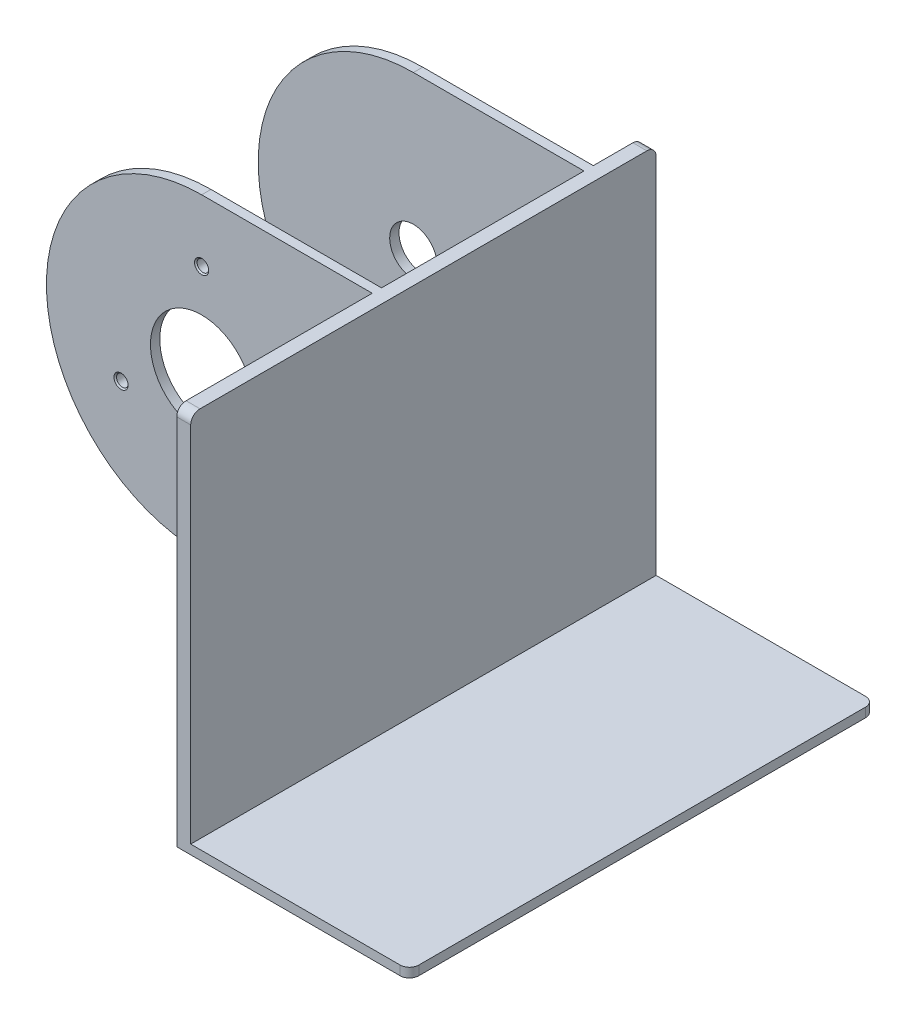
from build123d import *

# Parameters (mm, degrees)
SKETCH_1_W                   = 50
SKETCH_1_H                   = 100
EXTRUDE_1_DEPTH              = 2
SKETCH_2_W                   = 3
SKETCH_2_H                   = 100
EXTRUDE_2_DEPTH              = 80
SKETCH_3_W                   = 2
SKETCH_3_H                   = 66.7
EXTRUDE_3_DEPTH              = 70
CUT_EXTRUDE_4_REACH          = 162.465
SKETCH_8_W                   = 2
SKETCH_8_H                   = 66.7
EXTRUDE_4_DEPTH              = 70
CUT_EXTRUDE_5_REACH          = 140.25
HOLE_WIZARD_M3_1_D           = 2.5
HOLE_WIZARD_M3_1_DEPTH       = 2
HOLE_WIZARD_M3_1_CSINK_D     = 3.05
HOLE_WIZARD_M3_1_CSINK_ANGLE = 90
FILLET_1_R                   = 2
CUT_EXTRUDE_6_REACH          = 140.25
SKETCH_12_R                  = 11
CUT_EXTRUDE_7_REACH          = 162.465
SKETCH_13_R                  = 14.5
SKETCH_14_W                  = 2
SKETCH_14_H                  = 66.7
EXTRUDE_5_DEPTH              = 70
CUT_EXTRUDE_8_REACH          = 156.14
SKETCH_15_R                  = 5.1
CUT_EXTRUDE_9_DEPTH          = 155.140358116
CUT_EXTRUDE_9_DEPTH_BACK     = 155.140358116
SKETCH_19_W                  = 2
SKETCH_19_H                  = 66.7
CUT_EXTRUDE_10_DEPTH         = 119.844436134
FILLET_2_R                   = 2


with BuildPart() as part:
    # 草图1 → 凸台-拉伸1 (new body)
    with BuildSketch(Plane(origin=(0, 0, 0), x_dir=(1, 0, 0), z_dir=(0, 1, 0))):
        Rectangle(SKETCH_1_W, SKETCH_1_H)
    extrude(amount=EXTRUDE_1_DEPTH)

    # 草图2 → 凸台-拉伸2 (add)
    with BuildSketch(Plane(origin=(0, 2, 0), x_dir=(1, 0, 0), z_dir=(0, 1, 0))):
        with Locations((-23.5, 0)):
            Rectangle(SKETCH_2_W, SKETCH_2_H)
    extrude(amount=EXTRUDE_2_DEPTH)

    # 草图3 → 凸台-拉伸3 (add)
    with BuildSketch(Plane.ZY.offset(25)):
        with Locations((-49, 48.65)):
            Rectangle(SKETCH_3_W, SKETCH_3_H)
    extrude(amount=EXTRUDE_3_DEPTH)

    # 草图4 → 切除-拉伸4 (cut, up to next)
    with BuildSketch(Plane(origin=(0, 0, -50), x_dir=(-1, 0, 0), z_dir=(0, 0, -1)), mode=Mode.PRIVATE) as cut_extrude_4_sk1:
        with BuildLine():
            Line((95, 82), (61.65, 82))
            ThreePointArc((61.65, 82), (85.232011153, 72.232011153), (95, 48.65))
            Line((95, 48.65), (95, 82))
        make_face()
    cut_extrude_4_tool1 = extrude(cut_extrude_4_sk1.sketch, amount=-CUT_EXTRUDE_4_REACH, mode=Mode.PRIVATE) & part.part
    # 草图4 → 切除-拉伸4 (cut, up to next)
    with BuildSketch(Plane(origin=(0, 0, -50), x_dir=(-1, 0, 0), z_dir=(0, 0, -1)), mode=Mode.PRIVATE) as cut_extrude_4_sk2:
        with BuildLine():
            ThreePointArc((95, 48.65), (85.232011153, 25.067988847), (61.65, 15.3))
            Line((61.65, 15.3), (95, 15.3))
            Line((95, 15.3), (95, 48.65))
        make_face()
    cut_extrude_4_tool2 = extrude(cut_extrude_4_sk2.sketch, amount=-CUT_EXTRUDE_4_REACH, mode=Mode.PRIVATE) & part.part
    add(cut_extrude_4_tool1.solids().sort_by_distance((-87.550679, 74.550679, -50))[0], mode=Mode.SUBTRACT)
    add(cut_extrude_4_tool2.solids().sort_by_distance((-87.550679, 22.749321, -50))[0], mode=Mode.SUBTRACT)

    # 草图8 → 凸台-拉伸4 (add)
    with BuildSketch(Plane.ZY.offset(25)):
        with Locations((7, 48.65)):
            Rectangle(SKETCH_8_W, SKETCH_8_H)
    extrude(amount=EXTRUDE_4_DEPTH)

    # 草图9 → 切除-拉伸5 (cut, up to next)
    with BuildSketch(Plane.XY.offset(8), mode=Mode.PRIVATE) as cut_extrude_5_sk1:
        with BuildLine():
            ThreePointArc((-95, 48.65), (-85.232011153, 72.232011153), (-61.65, 82))
            Line((-61.65, 82), (-95, 82))
            Line((-95, 82), (-95, 48.65))
        make_face()
    cut_extrude_5_tool1 = extrude(cut_extrude_5_sk1.sketch, amount=-CUT_EXTRUDE_5_REACH, mode=Mode.PRIVATE) & part.part
    # 草图9 → 切除-拉伸5 (cut, up to next)
    with BuildSketch(Plane.XY.offset(8), mode=Mode.PRIVATE) as cut_extrude_5_sk2:
        with BuildLine():
            ThreePointArc((-61.65, 15.3), (-85.232011153, 25.067988847), (-95, 48.65))
            Line((-95, 48.65), (-95, 15.3))
            Line((-95, 15.3), (-61.65, 15.3))
        make_face()
    cut_extrude_5_tool2 = extrude(cut_extrude_5_sk2.sketch, amount=-CUT_EXTRUDE_5_REACH, mode=Mode.PRIVATE) & part.part
    add(cut_extrude_5_tool1.solids().sort_by_distance((-87.550679, 74.550679, 8))[0], mode=Mode.SUBTRACT)
    add(cut_extrude_5_tool2.solids().sort_by_distance((-87.550679, 22.749321, 8))[0], mode=Mode.SUBTRACT)

    # M3 螺纹孔1
    with Locations(Plane.XY.offset(8)):
        with Locations((-78.970508076, 38.65), (-61.65, 68.65), (-44.329491924, 38.65)):
            CounterSinkHole(HOLE_WIZARD_M3_1_D / 2, HOLE_WIZARD_M3_1_CSINK_D / 2, depth=HOLE_WIZARD_M3_1_DEPTH, counter_sink_angle=HOLE_WIZARD_M3_1_CSINK_ANGLE)

    # 圆角1
    fillet_1_edges = [part.edges().sort_by_distance(p)[0] for p in [
        (-23.5, 82, 50),
        (25, 1, 50),
        (25, 1, -50),
    ]]
    fillet(fillet_1_edges, radius=FILLET_1_R)

    # 草图12 → 切除-拉伸6 (cut, up to next)
    with BuildSketch(Plane.XY.offset(8), mode=Mode.PRIVATE) as cut_extrude_6_sk1:
        with Locations((-61.65, 48.65)):
            Circle(SKETCH_12_R)
    cut_extrude_6_tool1 = extrude(cut_extrude_6_sk1.sketch, amount=-CUT_EXTRUDE_6_REACH, mode=Mode.PRIVATE) & part.part
    add(cut_extrude_6_tool1.solids().sort_by_distance((-61.65, 48.65, 8))[0], mode=Mode.SUBTRACT)

    # 草图13 → 切除-拉伸7 (cut, up to next)
    with BuildSketch(Plane(origin=(0, 0, -50), x_dir=(-1, 0, 0), z_dir=(0, 0, -1)), mode=Mode.PRIVATE) as cut_extrude_7_sk1:
        with Locations((61.65, 48.65)):
            Circle(SKETCH_13_R)
    cut_extrude_7_tool1 = extrude(cut_extrude_7_sk1.sketch, amount=-CUT_EXTRUDE_7_REACH, mode=Mode.PRIVATE) & part.part
    add(cut_extrude_7_tool1.solids().sort_by_distance((-61.65, 48.65, -50))[0], mode=Mode.SUBTRACT)

    # 草图14 → 凸台-拉伸5 (add)
    with BuildSketch(Plane.ZY.offset(25)):
        with Locations((-38.5, 48.65)):
            Rectangle(SKETCH_14_W, SKETCH_14_H)
    extrude(amount=EXTRUDE_5_DEPTH)

    # 草图15 → 切除-拉伸8 (cut, up to next)
    with BuildSketch(Plane(origin=(0, 0, -39.5), x_dir=(-1, 0, 0), z_dir=(0, 0, -1)), mode=Mode.PRIVATE) as cut_extrude_8_sk1:
        with Locations(Location((61.65, 48.65, 0), (0, 0, 90))):
            Circle(SKETCH_15_R)
    cut_extrude_8_tool1 = extrude(cut_extrude_8_sk1.sketch, amount=-CUT_EXTRUDE_8_REACH, mode=Mode.PRIVATE) & part.part
    add(cut_extrude_8_tool1.solids().sort_by_distance((-61.65, 48.65, -39.5))[0], mode=Mode.SUBTRACT)

    # 草图18 → 切除-拉伸9 (cut, two sides: drawn at the far end of the back side and taken through both)
    with BuildSketch(Plane(origin=(0, 0, -39.5), x_dir=(-1, 0, 0), z_dir=(0, 0, -1)).offset(-CUT_EXTRUDE_9_DEPTH_BACK)):
        with BuildLine():
            Line((95, 15.3), (95, 48.65))
            ThreePointArc((95, 48.65), (85.232011153, 25.067988847), (61.65, 15.3))
            Line((61.65, 15.3), (95, 15.3))
        make_face()
        with BuildLine():
            Line((95, 48.65), (95, 82))
            Line((95, 82), (61.65, 82))
            ThreePointArc((61.65, 82), (85.232011153, 72.232011153), (95, 48.65))
        make_face()
    extrude(amount=CUT_EXTRUDE_9_DEPTH + CUT_EXTRUDE_9_DEPTH_BACK, mode=Mode.SUBTRACT)

    # 草图19 → 切除-拉伸10 (cut, through all)
    with BuildSketch(Plane.ZY.offset(25)):
        with Locations((-49, 48.65)):
            Rectangle(SKETCH_19_W, SKETCH_19_H)
    extrude(amount=CUT_EXTRUDE_10_DEPTH, mode=Mode.SUBTRACT)

    # 圆角2
    fillet_2_edges = [part.edges().sort_by_distance(p)[0] for p in [
        (-23.5, 82, -50),
    ]]
    fillet(fillet_2_edges, radius=FILLET_2_R)


solid = part.part
